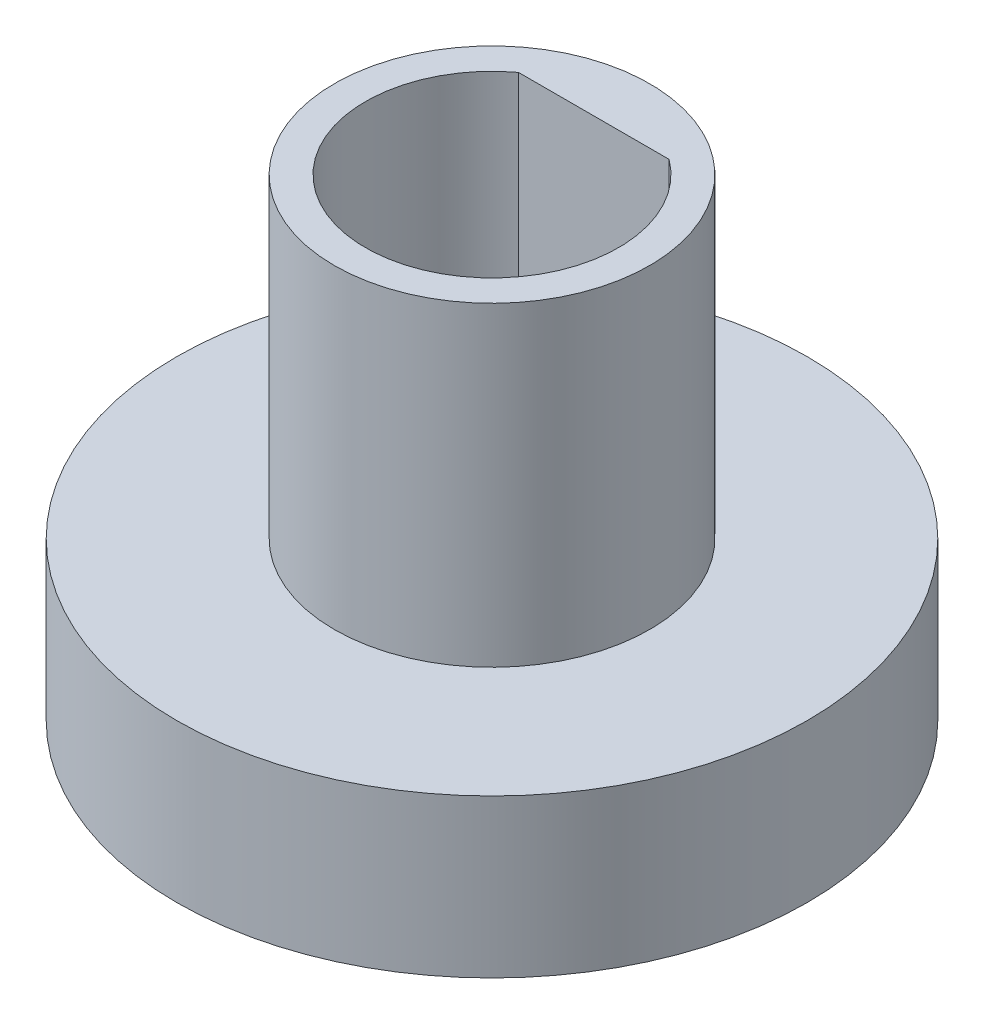
from build123d import *

# Parameters (mm, degrees)
SKETCH1_R           = 6.35
BOSS_EXTRUDE1_DEPTH = 3.175
SKETCH2_R           = 3.175
BOSS_EXTRUDE2_DEPTH = 6.35
CUT_EXTRUDE1_DEPTH  = 14.090860361


with BuildPart() as part:
    # Sketch1 → Boss-Extrude1 (new body)
    with BuildSketch(Plane(origin=(0, 0, 0), x_dir=(1, 0, 0), z_dir=(0, 1, 0))):
        with Locations(Location((0, 0, 0), (0, 0, 270))):
            Circle(SKETCH1_R)
    extrude(amount=BOSS_EXTRUDE1_DEPTH)

    # Sketch2 → Boss-Extrude2 (add)
    with BuildSketch(Plane(origin=(0, 3.175, 0), x_dir=(1, 0, 0), z_dir=(0, 1, 0))):
        with Locations(Location((0, 0, 0), (0, 0, 270))):
            Circle(SKETCH2_R)
    extrude(amount=BOSS_EXTRUDE2_DEPTH)

    # Sketch3 → Cut-Extrude1 (cut, through all)
    with BuildSketch(Plane(origin=(0, 9.525, 0), x_dir=(1, 0, 0), z_dir=(0, 1, 0))):
        with BuildLine():
            Line((-1.516575089, 2.05), (1.516575089, 2.05))
            ThreePointArc((1.516575089, 2.05), (0, -2.55), (-1.516575089, 2.05))
        make_face()
    extrude(amount=-CUT_EXTRUDE1_DEPTH, mode=Mode.SUBTRACT)


solid = part.part
